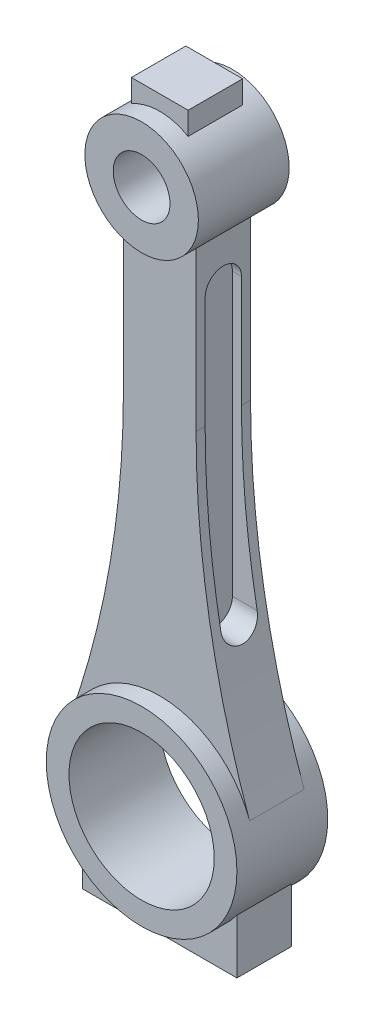
from build123d import *

# Parameters (mm, degrees)
SKETCH1_R             = 12.5
SKETCH1_R_2           = 6.25
BOSS_EXTRUDE1_DEPTH   = 10
SKETCH1_R_3           = 21
SKETCH1_R_4           = 16
BOSS_EXTRUDE1_2_DEPTH = 10
BOSS_EXTRUDE4_DEPTH   = 6
BOSS_EXTRUDE6_DEPTH   = 6
BOSS_EXTRUDE7_DEPTH   = 6
CUT_EXTRUDE1_START    = 6
CUT_EXTRUDE1_DEPTH    = 132.802456026
CUT_EXTRUDE3_START    = -6
CUT_EXTRUDE3_DEPTH    = 132.802456026


with BuildPart() as part:
    # Sketch1 → Boss-Extrude1 (new, symmetric)
    with BuildSketch(Plane.XY):
        with Locations((0, 120)):
            Circle(SKETCH1_R)
        with Locations((0, 120)):
            Circle(SKETCH1_R_2, mode=Mode.SUBTRACT)
    extrude(amount=BOSS_EXTRUDE1_DEPTH, both=True)



with BuildPart() as body_2:
    # Sketch1 → Boss-Extrude1 2 (new, symmetric)
    with BuildSketch(Plane.XY):
        Circle(SKETCH1_R_3)
        Circle(SKETCH1_R_4, mode=Mode.SUBTRACT)
    extrude(amount=BOSS_EXTRUDE1_2_DEPTH, both=True)


with BuildPart() as part_1:
    add(part.part)

    add(body_2.part)  # Boss-Extrude4 merges body 2
    # Sketch1<5> → Boss-Extrude4 (add, symmetric)
    with BuildSketch(Plane.XY):
        with BuildLine():
            ThreePointArc((8, 110.395313644), (0, 107.5), (-8, 110.395313644))
            Line((-8, 110.395313644), (-8, 75.395313644))
            ThreePointArc((-8, 75.395313644), (-10.96842855, 40.709642053), (-19.787382488, 7.032744434))
            ThreePointArc((-19.787382488, 7.032744434), (0, 21), (19.787382488, 7.032744434))
            ThreePointArc((19.787382488, 7.032744434), (10.96842855, 40.709642053), (8, 75.395313644))
            Line((8, 75.395313644), (8, 110.395313644))
        make_face()
    extrude(amount=BOSS_EXTRUDE4_DEPTH, both=True)

    # Sketch1<8> → Boss-Extrude6 (add, symmetric)
    with BuildSketch(Plane.XY):
        with BuildLine():
            ThreePointArc((16.961079982, -12.382316659), (-0.033074929, -20.999973954), (-17, -12.328828006))
            Line((-17, -12.328828006), (-17, -24.328828006))
            Line((-17, -24.328828006), (17, -24.328828006))
            Line((17, -24.328828006), (16.961079982, -12.382316659))
        make_face()
    extrude(amount=BOSS_EXTRUDE6_DEPTH, both=True)

    # Sketch1<9> → Boss-Extrude7 (add, symmetric)
    with BuildSketch(Plane.XY):
        with BuildLine():
            Line((-6.25, 135.825317547), (-6.25, 130.825317547))
            ThreePointArc((-6.25, 130.825317547), (0, 132.5), (6.25, 130.825317547))
            Line((6.25, 130.825317547), (6.25, 135.825317547))
            Line((6.25, 135.825317547), (-6.25, 135.825317547))
        make_face()
    extrude(amount=BOSS_EXTRUDE7_DEPTH, both=True)

    # Sketch4 → Cut-Extrude1 (cut, through all)
    with BuildSketch(Plane(origin=(0, 0, 0), x_dir=(0, 0, -1), z_dir=(1, 0, 0)).offset(CUT_EXTRUDE1_START)):
        with BuildLine():
            Line((4, 100), (4, 38))
            ThreePointArc((4, 38), (0, 34), (-4, 38))
            Line((-4, 38), (-4, 100))
            ThreePointArc((-4, 100), (0, 104), (4, 100))
        make_face()
    extrude(amount=CUT_EXTRUDE1_DEPTH, mode=Mode.SUBTRACT)

    # Sketch4<3> → Cut-Extrude3 (cut, through all)
    with BuildSketch(Plane(origin=(0, 0, 0), x_dir=(0, 0, -1), z_dir=(1, 0, 0)).offset(CUT_EXTRUDE3_START)):
        with BuildLine():
            Line((4, 100), (4, 38))
            ThreePointArc((4, 38), (0, 34), (-4, 38))
            Line((-4, 38), (-4, 100))
            ThreePointArc((-4, 100), (0, 104), (4, 100))
        make_face()
    extrude(amount=-CUT_EXTRUDE3_DEPTH, mode=Mode.SUBTRACT)


solid = part_1.part
